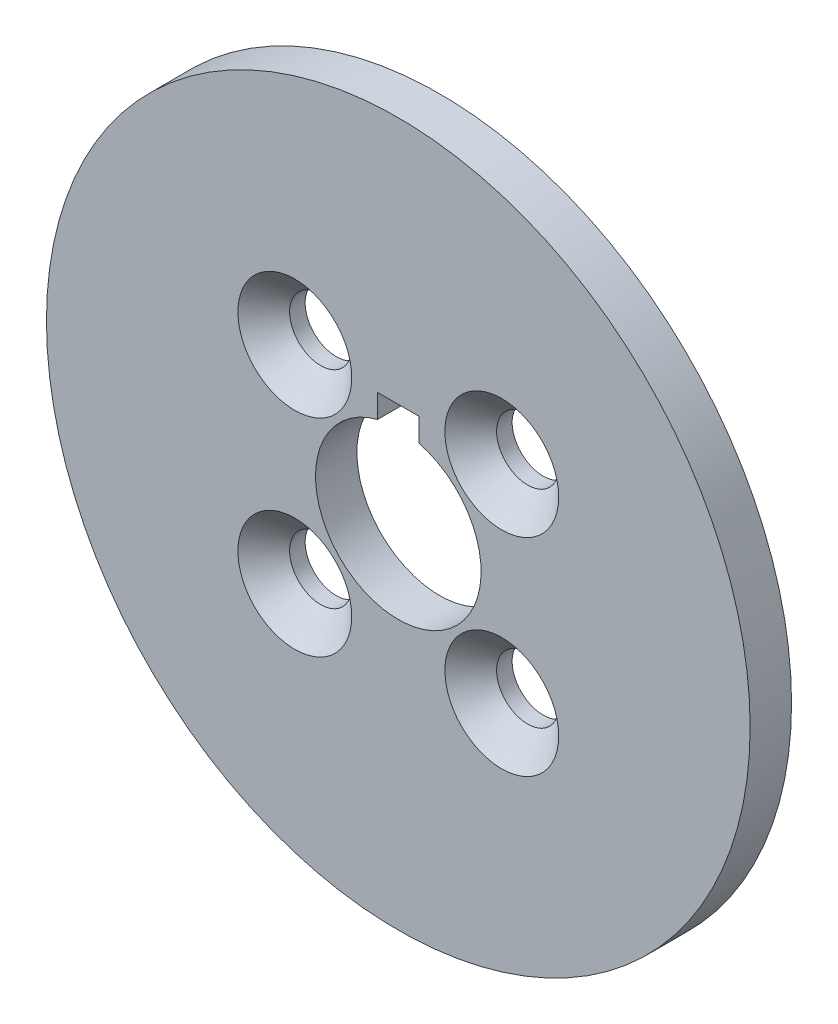
from build123d import *

# Parameters (mm, degrees)
SKETCH1_R           = 17
BOSS_EXTRUDE1_DEPTH = 2
CIRPATTERN1_COUNT   = 4


with BuildPart() as part:
    # Sketch1 → Boss-Extrude1 (new body)
    with BuildSketch(Plane.XY):
        Circle(SKETCH1_R)
        with BuildLine():
            Line((-1, 3.872983346), (-1, 5.002983346))
            Line((-1, 5.002983346), (1, 5.002983346))
            Line((1, 5.002983346), (1, 3.872983346))
            ThreePointArc((1, 3.872983346), (0, -4), (-1, 3.872983346))
        make_face(mode=Mode.SUBTRACT)
    extrude(amount=BOSS_EXTRUDE1_DEPTH)

    # Sketch4 → CSK for M2.5 Flat Head Machine Screw1 (revolve, cut)
    with BuildSketch(Plane(origin=(5, 5, 2), x_dir=(0, -1, 0), z_dir=(1, 0, 0))):
        Polygon((0, 0), (0, 2), (1.5, 2), (1.5, 1.25), (2.75, 0), align=None)
    csk_for_m2_5_flat_head_machine_screw1 = revolve(axis=Axis((5, 5, 8.35), (0, 0, -1)), mode=Mode.SUBTRACT)

    # CirPattern1: CSK for M2.5 Flat Head Machine Screw1 ×4 about axis
    cirpattern1_axis = Axis((0, 0, 0), (0, 0, 1))
    for i in range(1, CIRPATTERN1_COUNT):
        add(csk_for_m2_5_flat_head_machine_screw1.rotate(cirpattern1_axis, i * 360 / CIRPATTERN1_COUNT), mode=Mode.SUBTRACT)


solid = part.part
